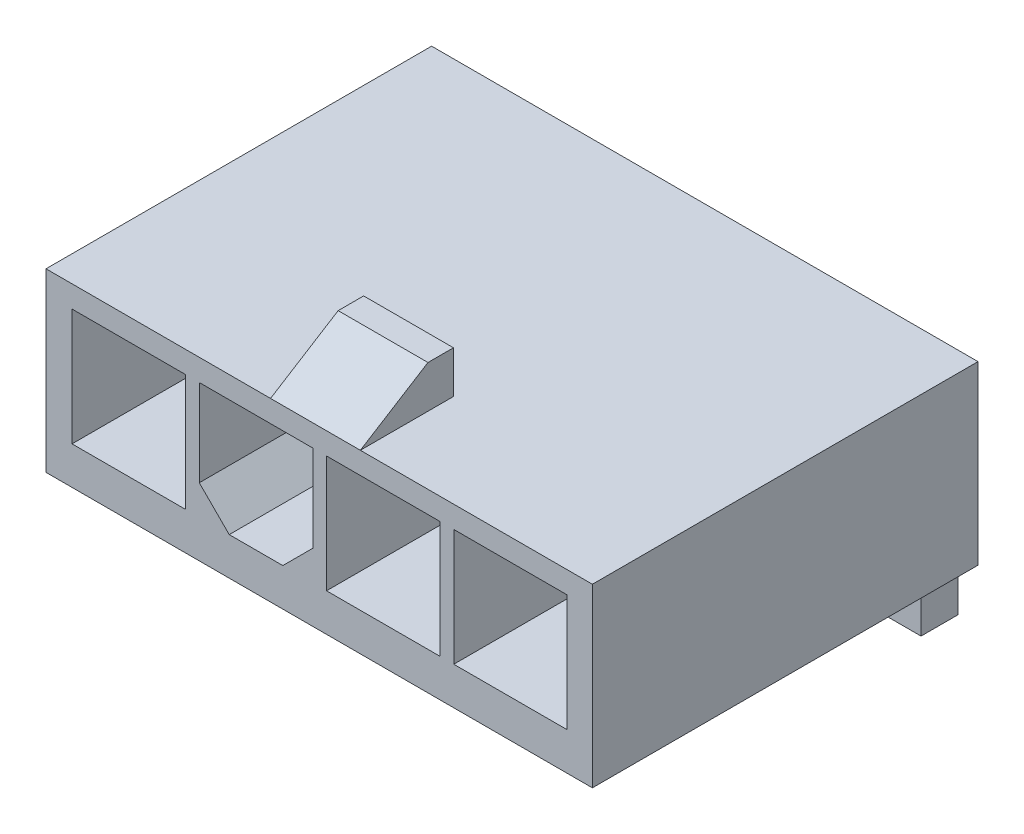
from build123d import *

# Parameters (mm, degrees)
SKETCH1_W           = 18.25
SKETCH1_H           = 12.88
BOSS_EXTRUDE1_DEPTH = 5.89
SKETCH2_W           = 3.79
SKETCH2_H           = 3.9
CUT_EXTRUDE1_DEPTH  = 9
SKETCH3_W           = 3
SKETCH3_H           = 3.11
BOSS_EXTRUDE2_DEPTH = 1.41
CUT_EXTRUDE2_DEPTH  = 3
SKETCH5_W           = 1.23
SKETCH5_H           = 1.23
CUT_EXTRUDE3_DEPTH  = 4
SKETCH8_W           = 1.23
SKETCH8_H           = 1.23


with BuildPart() as part:
    # Sketch1 → Boss-Extrude1 (new body)
    with BuildSketch(Plane(origin=(0, 0, 0), x_dir=(1, 0, 0), z_dir=(0, 1, 0))):
        with Locations((9.125, 6.44)):
            Rectangle(SKETCH1_W, SKETCH1_H)
    extrude(amount=BOSS_EXTRUDE1_DEPTH)

    # Sketch2 → Cut-Extrude1 (cut)
    with BuildSketch(Plane.XY):
        with Locations((2.765, 3.21048567)):
            Rectangle(SKETCH2_W, SKETCH2_H)
        Polygon((5.12, 5.16048567), (8.91, 5.16048567), (8.91, 2.26048567), (7.91, 1.26048567), (6.12, 1.26048567), (5.12, 2.26048567), align=None)
        with Locations((11.265, 3.21048567)):
            Rectangle(SKETCH2_W, SKETCH2_H)
        with Locations((15.515, 3.21048567)):
            Rectangle(SKETCH2_W, SKETCH2_H)
    extrude(amount=-CUT_EXTRUDE1_DEPTH, mode=Mode.SUBTRACT)

    # Sketch3 → Boss-Extrude2 (add)
    with BuildSketch(Plane(origin=(0, 5.89, 0), x_dir=(1, 0, 0), z_dir=(0, 1, 0))):
        with Locations((9, 1.555)):
            Rectangle(SKETCH3_W, SKETCH3_H)
    extrude(amount=BOSS_EXTRUDE2_DEPTH)

    # Sketch4 → Cut-Extrude2 (cut)
    with BuildSketch(Plane.ZY.offset(-7.5)):
        Polygon((-2.258367839, 7.3), (0, 5.89), (0, 7.3), align=None)
    extrude(amount=-CUT_EXTRUDE2_DEPTH, mode=Mode.SUBTRACT)

    # Sketch5 → Cut-Extrude3 (cut)
    with BuildSketch(Plane(origin=(0, 0, -12.88), x_dir=(-1, 0, 0), z_dir=(0, 0, -1))):
        with Locations((-2.785, 2.645)):
            Rectangle(SKETCH5_W, SKETCH5_H)
        with Locations((-6.990239219, 2.642823938)):
            Rectangle(SKETCH5_W, SKETCH5_H)
        with Locations((-11.195478439, 2.640647876)):
            Rectangle(SKETCH5_W, SKETCH5_H)
        with Locations((-15.400717658, 2.638471814)):
            Rectangle(SKETCH5_W, SKETCH5_H)
    extrude(amount=-CUT_EXTRUDE3_DEPTH, mode=Mode.SUBTRACT)

    # Sweep2: sweep along a path in Sketch7
    with BuildLine(Plane.ZY) as sweep2_path:
        Line((-4.3, 2.72), (-12.700459496, 2.72))
        ThreePointArc((-12.700459496, 2.72), (-13.534520585, 2.374520585), (-13.88, 1.540459496))
        Line((-13.88, 1.540459496), (-13.88, -3.3375))
    # Sketch8 → Sweep2 (sweep)
    with BuildSketch(Plane.XZ.offset(3.3375)):
        with Locations((15.397064507, -13.830209109)):
            Rectangle(SKETCH8_W, SKETCH8_H)
        with Locations((11.191825288, -13.832385171)):
            Rectangle(SKETCH8_W, SKETCH8_H)
        with Locations((6.986586068, -13.834561233)):
            Rectangle(SKETCH8_W, SKETCH8_H)
        with Locations((2.781346849, -13.836737294)):
            Rectangle(SKETCH8_W, SKETCH8_H)
    sweep(path=sweep2_path.line)


solid = part.part
